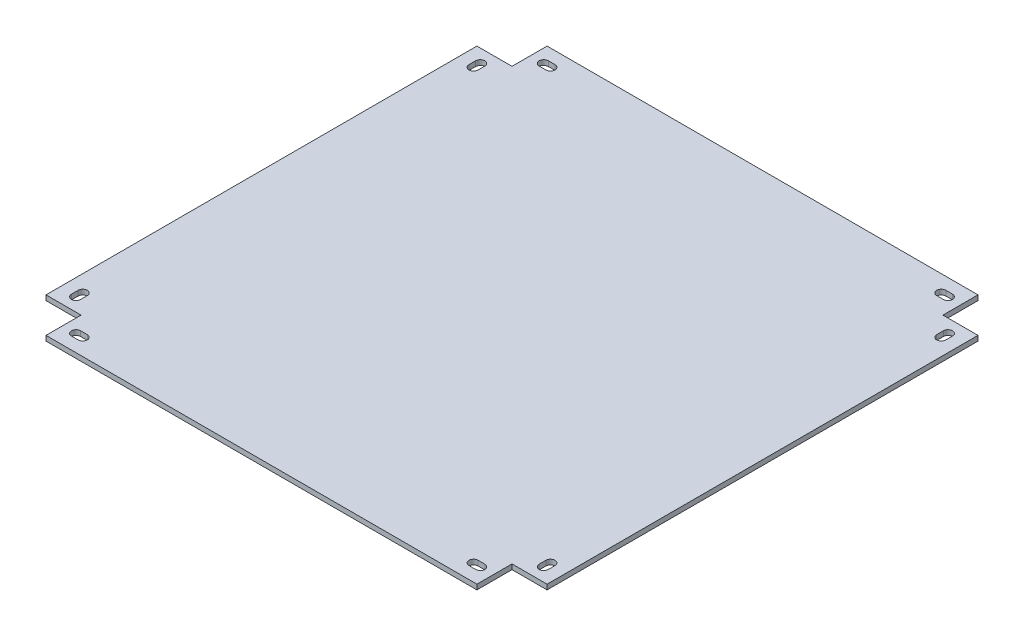
from build123d import *

# Parameters (mm, degrees)
BOSS_EXTRUDE1_DEPTH = 3


with BuildPart() as part:
    # Sketch1 → Boss-Extrude1 (new body)
    with BuildSketch(Plane(origin=(0, 0, 0), x_dir=(1, 0, 0), z_dir=(0, 1, 0))):
        Polygon((-129, -129), (-129, -150), (129, -150), (129, -129), (150, -129), (150, 129), (129, 129), (129, 150), (-129, 150), (-129, 129), (-150, 129), (-150, -129), align=None)
        with BuildLine():
            Line((-117, -142.75), (-121, -142.75))
            ThreePointArc((-121, -142.75), (-123.75, -140), (-121, -137.25))
            Line((-121, -137.25), (-117, -137.25))
            ThreePointArc((-117, -137.25), (-114.25, -140), (-117, -142.75))
        make_face(mode=Mode.SUBTRACT)
        with BuildLine():
            Line((-137.25, -117), (-137.25, -121))
            ThreePointArc((-137.25, -121), (-140, -123.75), (-142.75, -121))
            Line((-142.75, -121), (-142.75, -117))
            ThreePointArc((-142.75, -117), (-140, -114.25), (-137.25, -117))
        make_face(mode=Mode.SUBTRACT)
        with BuildLine():
            ThreePointArc((121, -137.25), (123.75, -140), (121, -142.75))
            Line((121, -142.75), (117, -142.75))
            ThreePointArc((117, -142.75), (114.25, -140), (117, -137.25))
            Line((117, -137.25), (121, -137.25))
        make_face(mode=Mode.SUBTRACT)
        with BuildLine():
            ThreePointArc((142.75, -121), (140, -123.75), (137.25, -121))
            Line((137.25, -121), (137.25, -117))
            ThreePointArc((137.25, -117), (140, -114.25), (142.75, -117))
            Line((142.75, -117), (142.75, -121))
        make_face(mode=Mode.SUBTRACT)
        with BuildLine():
            ThreePointArc((-142.75, 121), (-140, 123.75), (-137.25, 121))
            Line((-137.25, 121), (-137.25, 117))
            ThreePointArc((-137.25, 117), (-140, 114.25), (-142.75, 117))
            Line((-142.75, 117), (-142.75, 121))
        make_face(mode=Mode.SUBTRACT)
        with BuildLine():
            ThreePointArc((-121, 137.25), (-123.75, 140), (-121, 142.75))
            Line((-121, 142.75), (-117, 142.75))
            ThreePointArc((-117, 142.75), (-114.25, 140), (-117, 137.25))
            Line((-117, 137.25), (-121, 137.25))
        make_face(mode=Mode.SUBTRACT)
        with BuildLine():
            Line((137.25, 117), (137.25, 121))
            ThreePointArc((137.25, 121), (140, 123.75), (142.75, 121))
            Line((142.75, 121), (142.75, 117))
            ThreePointArc((142.75, 117), (140, 114.25), (137.25, 117))
        make_face(mode=Mode.SUBTRACT)
        with BuildLine():
            Line((117, 142.75), (121, 142.75))
            ThreePointArc((121, 142.75), (123.75, 140), (121, 137.25))
            Line((121, 137.25), (117, 137.25))
            ThreePointArc((117, 137.25), (114.25, 140), (117, 142.75))
        make_face(mode=Mode.SUBTRACT)
    extrude(amount=BOSS_EXTRUDE1_DEPTH)


solid = part.part
